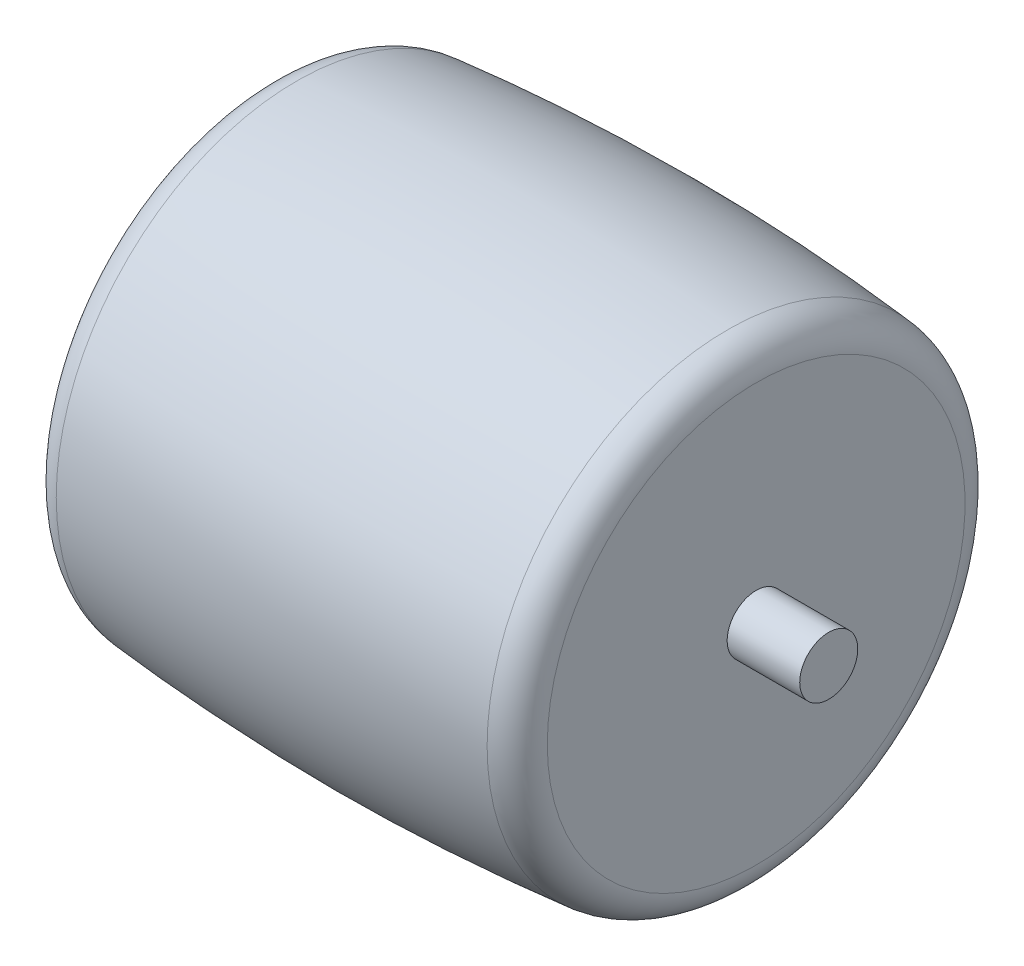
from build123d import *


with BuildPart() as part:
    # 草图1 → 旋转1 (revolve)
    with BuildSketch(Plane(origin=(0, 0, 0), x_dir=(1, 0, 0), z_dir=(0, 1, 0)), mode=Mode.PRIVATE) as revolve_1_sk:
        with BuildLine():
            Line((-12, 0), (12, 0))
            Line((12, 0), (12, 1.1))
            Line((12, 1.1), (9.25, 1.1))
            Line((9.25, 1.1), (9.25, 7.915940664))
            ThreePointArc((9.25, 7.915940664), (8.937946411, 8.723127861), (8.164081381, 9.110505622))
            add(Edge.make_bspline(
                [(8.164081381, 9.110505622), (5.535370052, 9.361548494), (0.026154039, 9.640968889), (-5.587611319, 9.356513757), (-8.164031617, 9.110573004)],
                knots=[0.05870374, 0.05870374, 0.05870374, 0.05870374, 0.499984959, 0.941263527, 0.941263527, 0.941263527, 0.941263527], degree=3))
            ThreePointArc((-8.164031617, 9.110573004), (-8.937929598, 8.723208987), (-9.25, 7.916003295))
            Line((-9.25, 7.916003295), (-9.25, 1.1))
            Line((-9.25, 1.1), (-12, 1.1))
            Line((-12, 1.1), (-12, 0))
        make_face()
    revolve(revolve_1_sk.sketch.rotate(Axis((-12, 0, 0), (1, 0, 0)), 180), axis=Axis((-12, 0, 0), (1, 0, 0)))


solid = part.part
